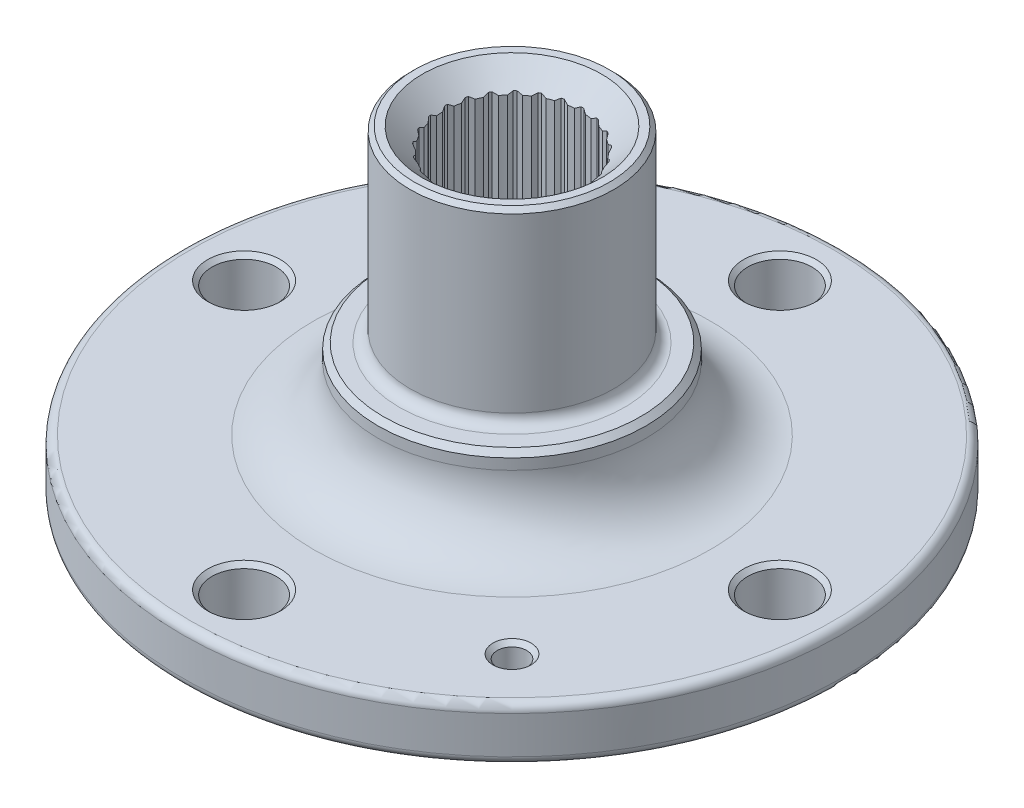
from build123d import *

# Parameters (mm, degrees)
FILETE1_R             = 12
FILETE2_R             = 2
CHANFRO1_SIZE         = 0.8
ESBO_O2_R             = 6
ESBO_O2_R_2           = 2.75
CORTE_EXTRUS_O1_DEPTH = 106.662197592
CHANFRO2_SIZE         = 0.8
FILETE3_R             = 1.5
FILETE4_R             = 1.5
CHANFRO3_SIZE         = 1
FILETE5_R             = 1.5
CHANFRO4_SIZE         = 0.8
FILETE6_R             = 2
CHANFRO5_SIZE         = 4
CHANFRO6_SIZE         = 0.5
CHANFRO6_SIZE2        = 0.288675135
FILETE7_R             = 1.5
CORTE_EXTRUS_O2_DEPTH = 117.161525525


with BuildPart() as part:
    # Esboço1 → Revolução1 (revolve)
    with BuildSketch(Plane.XY, mode=Mode.PRIVATE) as revolu_o1_sk:
        Polygon((12.75, 53.208582503), (19, 53.208582503), (19, 18.208582503), (25, 18.208582503), (25, 3.208582503), (61.5, 3.208582503), (61.5, -6.791417497), (31, -6.791417497), (31, -12.791417497), (27, -12.791417497), (27, -23.791417497), (24, -23.791417497), (24, 0), (12.75, 0), align=None)
    revolve(revolu_o1_sk.sketch.rotate(Axis((0, -42.677906977, 0), (0, 1, 0)), 90), axis=Axis((0, -42.677906977, 0), (0, 1, 0)))

    # Filete1
    filete1_edges = [part.edges().sort_by_distance(p)[0] for p in [
        (0, 3.208582503, 25),
    ]]
    fillet(filete1_edges, radius=FILETE1_R)

    # Filete2
    filete2_edges = [part.edges().sort_by_distance(p)[0] for p in [
        (0, 18.208582503, 19),
    ]]
    fillet(filete2_edges, radius=FILETE2_R)

    # Chanfro1
    chanfro1_edges = [part.edges().sort_by_distance(p)[0] for p in [
        (0, 53.208582503, 19),
    ]]
    chamfer(chanfro1_edges, length=CHANFRO1_SIZE)

    # Esboço2 → Corte-extrusão1 (cut, through all)
    with BuildSketch(Plane.XZ.offset(6.791417497)):
        with Locations(Location((0, 50, 0), (0, 0, 270))):
            Circle(ESBO_O2_R)
        with Locations(Location((-35.355339059, -35.355339059, 0), (0, 0, 270))):
            Circle(ESBO_O2_R_2)
        with Locations(Location((50, 0, 0), (0, 0, 270))):
            Circle(ESBO_O2_R)
        with Locations(Location((35.355339059, 35.355339059, 0), (0, 0, 270))):
            Circle(ESBO_O2_R_2)
        with Locations(Location((0, -50, 0), (0, 0, 270))):
            Circle(ESBO_O2_R)
        with Locations(Location((-50, 0, 0), (0, 0, 270))):
            Circle(ESBO_O2_R)
    extrude(amount=-CORTE_EXTRUS_O1_DEPTH, mode=Mode.SUBTRACT)

    # Chanfro2
    chanfro2_edges = [part.edges().sort_by_distance(p)[0] for p in [
        (0, 3.208582503, 56),
        (0, -6.791417497, 56),
        (35.355339059, 3.208582503, 38.105339059),
        (35.355339059, -6.791417497, 38.105339059),
        (-35.355339059, 3.208582503, -32.605339059),
        (-35.355339059, -6.791417497, -32.605339059),
        (50, 3.208582503, 6),
        (50, -6.791417497, 6),
        (0, 3.208582503, -44),
        (0, -6.791417497, -44),
        (-50, 3.208582503, 6),
        (-50, -6.791417497, 6),
    ]]
    chamfer(chanfro2_edges, length=CHANFRO2_SIZE)

    # Filete3
    filete3_edges = [part.edges().sort_by_distance(p)[0] for p in [
        (0, -6.791417497, 61.5),
    ]]
    fillet(filete3_edges, radius=FILETE3_R)

    # Filete4
    filete4_edges = [part.edges().sort_by_distance(p)[0] for p in [
        (0, 3.208582503, 61.5),
    ]]
    fillet(filete4_edges, radius=FILETE4_R)

    # Chanfro3
    chanfro3_edges = [part.edges().sort_by_distance(p)[0] for p in [
        (0, 18.208582503, 25),
    ]]
    chamfer(chanfro3_edges, length=CHANFRO3_SIZE)

    # Filete5
    filete5_edges = [part.edges().sort_by_distance(p)[0] for p in [
        (0, -6.791417497, 31),
    ]]
    fillet(filete5_edges, radius=FILETE5_R)

    # Chanfro4
    chanfro4_edges = [part.edges().sort_by_distance(p)[0] for p in [
        (0, -23.791417497, 24),
        (0, -23.791417497, 27),
        (0, -12.791417497, 31),
    ]]
    chamfer(chanfro4_edges, length=CHANFRO4_SIZE)

    # Filete6
    filete6_edges = [part.edges().sort_by_distance(p)[0] for p in [
        (0, -12.791417497, 27),
    ]]
    fillet(filete6_edges, radius=FILETE6_R)

    # Chanfro5
    chanfro5_edges = [part.edges().sort_by_distance(p)[0] for p in [
        (0, 53.208582503, 12.75),
    ]]
    chamfer(chanfro5_edges, length=CHANFRO5_SIZE)

    # Chanfro6
    chanfro6_edges = [part.edges().sort_by_distance(p)[0] for p in [
        (0, 0, 12.75),
    ]]
    chanfro6_side = [part.faces().sort_by_distance(p)[0] for p in [
        (0, 0, 23.32117749),
    ]]
    chamfer(chanfro6_edges, length=CHANFRO6_SIZE, length2=CHANFRO6_SIZE2, reference=chanfro6_side[0])

    # Filete7
    filete7_edges = [part.edges().sort_by_distance(p)[0] for p in [
        (0, 0, 24),
    ]]
    fillet(filete7_edges, radius=FILETE7_R)

    # Esboço4 → Corte-extrusão2 (cut, through all)
    with BuildSketch(Plane(origin=(0, 53.208582503, 0), x_dir=(1, 0, 0), z_dir=(0, 1, 0))):
        with BuildLine():
            Line((2.192445311, 12.560082944), (3.027535179, 12.796739067))
            ThreePointArc((3.027535179, 12.796739067), (3.270272016, 12.736868569), (3.51182676, 12.672394123))
            Line((3.51182676, 12.672394123), (4.129611633, 12.06270317))
            ThreePointArc((4.129611633, 12.06270317), (3.170796061, 12.349435304), (2.192445311, 12.560082944))
        make_face()
        with BuildLine():
            Line((-1, 12.710723819), (-0.25, 13.147623359))
            ThreePointArc((-0.25, 13.147623359), (0, 13.15), (0.25, 13.147623359))
            Line((0.25, 13.147623359), (1, 12.710723819))
            ThreePointArc((1, 12.710723819), (0, 12.75), (-1, 12.710723819))
        make_face()
        with BuildLine():
            Line((5.24713122, 11.620245865), (6.114839189, 11.641788595))
            ThreePointArc((6.114839189, 11.641788595), (6.335060814, 11.523432843), (6.552992529, 11.400911758))
            Line((6.552992529, 11.400911758), (6.99974458, 10.656738517))
            ThreePointArc((6.99974458, 10.656738517), (6.142359345, 11.172910171), (5.24713122, 11.620245865))
        make_face()
        with BuildLine():
            Line((7.972120577, 9.950266002), (8.817925364, 9.755341731))
            ThreePointArc((8.817925364, 9.755341731), (9.001794443, 9.585937451), (9.182409677, 9.413068178))
            Line((9.182409677, 9.413068178), (9.430057832, 8.58117179))
            ThreePointArc((9.430057832, 8.58117179), (8.727975601, 9.29435), (7.972120577, 9.950266002))
        make_face()
        with BuildLine():
            Line((10.196192279, 7.655074331), (10.966948858, 7.255930868))
            ThreePointArc((10.966948858, 7.255930868), (11.10291222, 7.046122354), (11.234862255, 6.833766905))
            Line((11.234862255, 6.833766905), (11.267845869, 5.96641848))
            ThreePointArc((11.267845869, 5.96641848), (10.76518105, 6.831791636), (10.196192279, 7.655074331))
        make_face()
        with BuildLine():
            Line((11.77959972, 4.878886187), (12.426878621, 4.300603183))
            ThreePointArc((12.426878621, 4.300603183), (12.506393189, 4.063573476), (12.581387118, 3.825074925))
            Line((12.581387118, 3.825074925), (12.397633709, 2.976773155))
            ThreePointArc((12.397633709, 2.976773155), (12.125970583, 3.939966678), (11.77959972, 4.878886187))
        make_face()
        with BuildLine():
            Line((12.622851589, 1.796139681), (13.105981898, 1.075052783))
            ThreePointArc((13.105981898, 1.075052783), (13.124051479, 0.825695332), (13.137377158, 0.576039419))
            Line((13.137377158, 0.576039419), (12.748432628, -0.199913776))
            ThreePointArc((12.748432628, -0.199913776), (12.724840787, 0.800579124), (12.622851589, 1.796139681))
        make_face()
        with BuildLine():
            Line((12.672963269, -1.399464888), (12.961588132, -2.218047136))
            ThreePointArc((12.961588132, -2.218047136), (12.917077347, -2.464064287), (12.867897475, -2.709190761))
            Line((12.867897475, -2.709190761), (12.29820064, -3.364039389))
            ThreePointArc((12.29820064, -3.364039389), (12.524162447, -2.389111761), (12.672963269, -1.399464888))
        make_face()
        with BuildLine():
            Line((11.926786059, -4.50713593), (12.002770114, -5.371778997))
            ThreePointArc((12.002770114, -5.371778997), (11.89847574, -5.598997684), (11.789880468, -5.824192523))
            Line((11.789880468, -5.824192523), (11.075227476, -6.316790035))
            ThreePointArc((11.075227476, -6.316790035), (11.536544919, -5.428685967), (11.926786059, -4.50713593))
        make_face()
        with BuildLine():
            Line((10.431205017, -7.331607046), (10.289773907, -8.187982227))
            ThreePointArc((10.289773907, -8.187982227), (10.132249143, -8.382125465), (9.971061912, -8.573238848))
            Line((9.971061912, -8.573238848), (9.156357038, -8.872633532))
            ThreePointArc((9.156357038, -8.872633532), (9.824043845, -8.127155869), (10.431205017, -7.331607046))
        make_face()
        with BuildLine():
            Line((8.280193001, -9.695406328), (7.930233362, -10.48970442))
            ThreePointArc((7.930233362, -10.48970442), (7.729376068, -10.638573476), (7.525724865, -10.783597046))
            Line((7.525724865, -10.783597046), (6.662159012, -10.870976833))
            ThreePointArc((6.662159012, -10.870976833), (7.494261967, -10.314966678), (8.280193001, -9.695406328))
        make_face()
        with BuildLine():
            Line((5.608906006, -11.450007573), (5.072407089, -12.132319907))
            ThreePointArc((5.072407089, -12.132319907), (4.840837868, -12.226560789), (4.607518847, -12.316382183))
            Line((4.607518847, -12.316382183), (3.749353034, -12.186256678))
            ThreePointArc((3.749353034, -12.186256678), (4.693588047, -11.854650195), (5.608906006, -11.450007573))
        make_face()
        with BuildLine():
            Line((2.585190818, -12.485162731), (1.895862825, -13.012617114))
            ThreePointArc((1.895862825, -13.012617114), (1.648132021, -13.046308322), (1.399805474, -13.075283731))
            Line((1.399805474, -13.075283731), (0.600961416, -12.735829199))
            ThreePointArc((0.600961416, -12.735829199), (1.597998728, -12.649462442), (2.585190818, -12.485162731))
        make_face()
        with BuildLine():
            Line((-0.600961416, -12.735829199), (-1.399805474, -13.075283731))
            ThreePointArc((-1.399805474, -13.075283731), (-1.648132021, -13.046308322), (-1.895862825, -13.012617114))
            Line((-1.895862825, -13.012617114), (-2.585190818, -12.485162731))
            ThreePointArc((-2.585190818, -12.485162731), (-1.597998728, -12.649462442), (-0.600961416, -12.735829199))
        make_face()
        with BuildLine():
            Line((-3.749353034, -12.186256678), (-4.607518847, -12.316382183))
            ThreePointArc((-4.607518847, -12.316382183), (-4.840837868, -12.226560789), (-5.072407089, -12.132319907))
            Line((-5.072407089, -12.132319907), (-5.608906006, -11.450007573))
            ThreePointArc((-5.608906006, -11.450007573), (-4.693588047, -11.854650195), (-3.749353034, -12.186256678))
        make_face()
        with BuildLine():
            Line((-6.662159012, -10.870976833), (-7.525724865, -10.783597046))
            ThreePointArc((-7.525724865, -10.783597046), (-7.729376068, -10.638573476), (-7.930233362, -10.48970442))
            Line((-7.930233362, -10.48970442), (-8.280193001, -9.695406328))
            ThreePointArc((-8.280193001, -9.695406328), (-7.494261967, -10.314966678), (-6.662159012, -10.870976833))
        make_face()
        with BuildLine():
            Line((-9.156357038, -8.872633532), (-9.971061912, -8.573238848))
            ThreePointArc((-9.971061912, -8.573238848), (-10.132249143, -8.382125465), (-10.289773907, -8.187982227))
            Line((-10.289773907, -8.187982227), (-10.431205017, -7.331607046))
            ThreePointArc((-10.431205017, -7.331607046), (-9.824043845, -8.127155869), (-9.156357038, -8.872633532))
        make_face()
        with BuildLine():
            Line((-11.075227476, -6.316790035), (-11.789880468, -5.824192523))
            ThreePointArc((-11.789880468, -5.824192523), (-11.89847574, -5.598997684), (-12.002770114, -5.371778997))
            Line((-12.002770114, -5.371778997), (-11.926786059, -4.50713593))
            ThreePointArc((-11.926786059, -4.50713593), (-11.536544919, -5.428685967), (-11.075227476, -6.316790035))
        make_face()
        with BuildLine():
            Line((-12.29820064, -3.364039389), (-12.867897475, -2.709190761))
            ThreePointArc((-12.867897475, -2.709190761), (-12.917077347, -2.464064287), (-12.961588132, -2.218047136))
            Line((-12.961588132, -2.218047136), (-12.672963269, -1.399464888))
            ThreePointArc((-12.672963269, -1.399464888), (-12.524162447, -2.389111761), (-12.29820064, -3.364039389))
        make_face()
        with BuildLine():
            Line((-12.748432628, -0.199913776), (-13.137377158, 0.576039419))
            ThreePointArc((-13.137377158, 0.576039419), (-13.124051479, 0.825695332), (-13.105981898, 1.075052783))
            Line((-13.105981898, 1.075052783), (-12.622851589, 1.796139681))
            ThreePointArc((-12.622851589, 1.796139681), (-12.724840787, 0.800579124), (-12.748432628, -0.199913776))
        make_face()
        with BuildLine():
            Line((-12.397633709, 2.976773155), (-12.581387118, 3.825074925))
            ThreePointArc((-12.581387118, 3.825074925), (-12.506393189, 4.063573476), (-12.426878621, 4.300603183))
            Line((-12.426878621, 4.300603183), (-11.77959972, 4.878886187))
            ThreePointArc((-11.77959972, 4.878886187), (-12.125970583, 3.939966678), (-12.397633709, 2.976773155))
        make_face()
        with BuildLine():
            Line((-11.267845869, 5.96641848), (-11.234862255, 6.833766905))
            ThreePointArc((-11.234862255, 6.833766905), (-11.10291222, 7.046122354), (-10.966948858, 7.255930868))
            Line((-10.966948858, 7.255930868), (-10.196192279, 7.655074331))
            ThreePointArc((-10.196192279, 7.655074331), (-10.76518105, 6.831791636), (-11.267845869, 5.96641848))
        make_face()
        with BuildLine():
            Line((-9.430057832, 8.58117179), (-9.182409677, 9.413068178))
            ThreePointArc((-9.182409677, 9.413068178), (-9.001794443, 9.585937451), (-8.817925364, 9.755341731))
            Line((-8.817925364, 9.755341731), (-7.972120577, 9.950266002))
            ThreePointArc((-7.972120577, 9.950266002), (-8.727975601, 9.29435), (-9.430057832, 8.58117179))
        make_face()
        with BuildLine():
            Line((-6.99974458, 10.656738517), (-6.552992529, 11.400911758))
            ThreePointArc((-6.552992529, 11.400911758), (-6.335060814, 11.523432843), (-6.114839189, 11.641788595))
            Line((-6.114839189, 11.641788595), (-5.24713122, 11.620245865))
            ThreePointArc((-5.24713122, 11.620245865), (-6.142359345, 11.172910171), (-6.99974458, 10.656738517))
        make_face()
        with BuildLine():
            Line((-4.129611633, 12.06270317), (-3.51182676, 12.672394123))
            ThreePointArc((-3.51182676, 12.672394123), (-3.270272016, 12.736868569), (-3.027535179, 12.796739067))
            Line((-3.027535179, 12.796739067), (-2.192445311, 12.560082944))
            ThreePointArc((-2.192445311, 12.560082944), (-3.170796061, 12.349435304), (-4.129611633, 12.06270317))
        make_face()
    extrude(amount=-CORTE_EXTRUS_O2_DEPTH, mode=Mode.SUBTRACT)


solid = part.part
